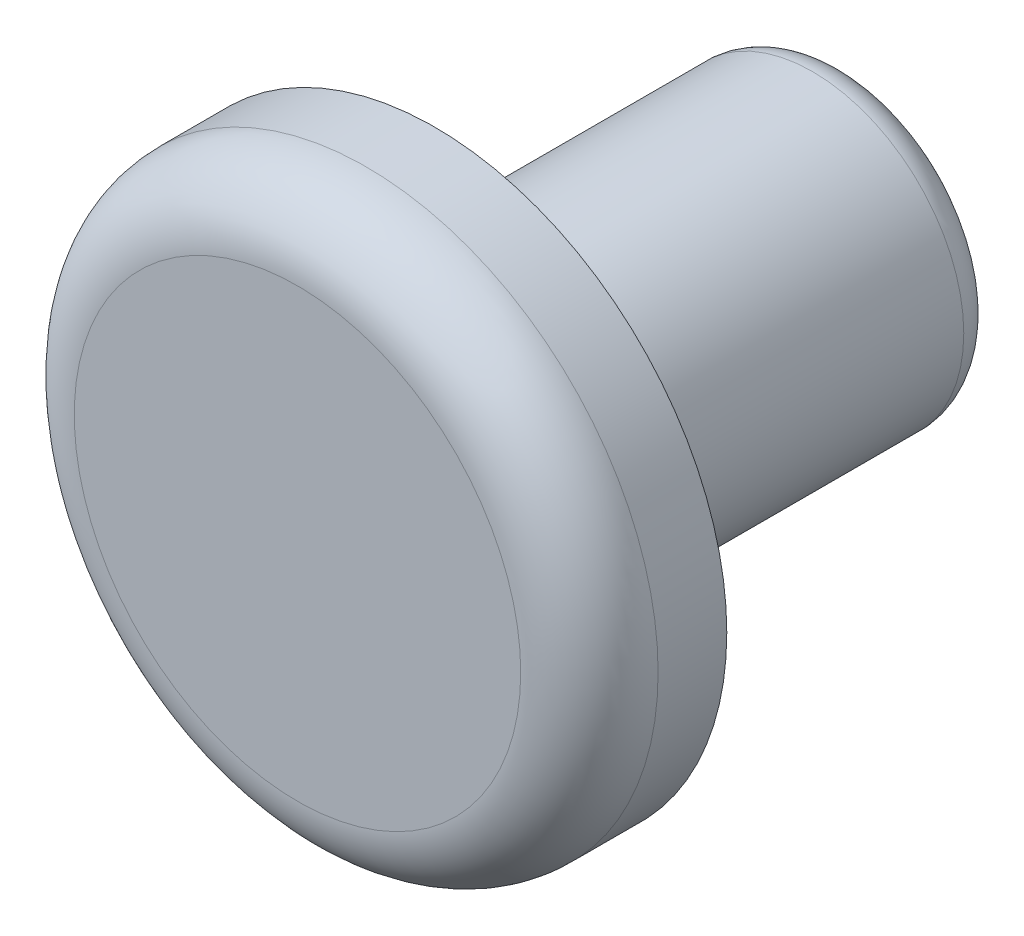
from build123d import *

# Parameters (mm, degrees)
ESQUISSE1_R        = 2.125
BOSS_EXTRU_1_DEPTH = 1
ESQUISSE2_R        = 1.1
BOSS_EXTRU_2_DEPTH = 3
CONG_2_R           = 0.5
CONG_3_R           = 0.25


with BuildPart() as part:
    # Esquisse1 → Boss.-Extru.1 (new body)
    with BuildSketch(Plane.XY):
        Circle(ESQUISSE1_R)
    extrude(amount=BOSS_EXTRU_1_DEPTH)

    # Esquisse2 → Boss.-Extru.2 (add)
    with BuildSketch(Plane(origin=(0, 0, 0), x_dir=(-1, 0, 0), z_dir=(0, 0, -1))):
        Circle(ESQUISSE2_R)
    extrude(amount=BOSS_EXTRU_2_DEPTH)

    # Congé2
    cong_2_edges = [part.edges().sort_by_distance(p)[0] for p in [
        (-2.125, 0, 1),
    ]]
    fillet(cong_2_edges, radius=CONG_2_R)

    # Congé3
    cong_3_edges = [part.edges().sort_by_distance(p)[0] for p in [
        (1.1, 0, -3),
    ]]
    fillet(cong_3_edges, radius=CONG_3_R)


solid = part.part
